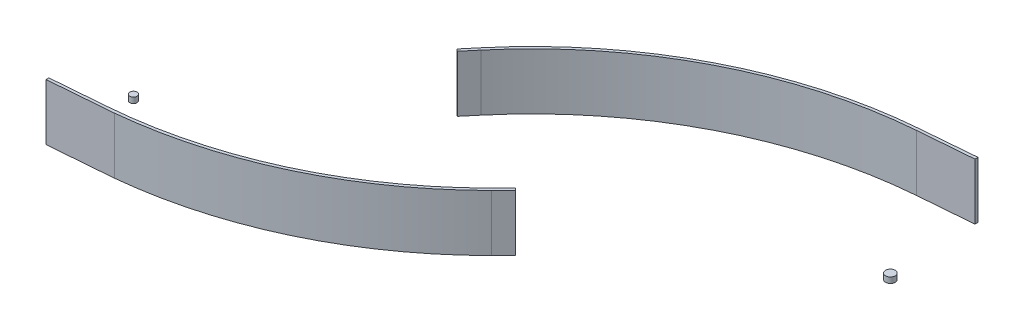
from build123d import *

# Parameters (mm, degrees)
BOSS_EXTRUDE3_DEPTH   = 100
BOSS_EXTRUDE3_2_DEPTH = 100
SKETCH4_R             = 8.59707886
BOSS_EXTRUDE4_DEPTH   = 10
SKETCH4_R_2           = 6.416603948
BOSS_EXTRUDE4_2_DEPTH = 10
SKETCH5_R             = 6.416603948
BOSS_EXTRUDE5_DEPTH   = 10
SKETCH6_R             = 6.416603948
CUT_EXTRUDE1_DEPTH    = 10
SKETCH7_R             = 8.59707886
BOSS_EXTRUDE6_DEPTH   = 10
SKETCH8_R             = 8.59707886
CUT_EXTRUDE2_DEPTH    = 10


with BuildPart() as part:
    # Sketch1 → Boss-Extrude3 (new body)
    with BuildSketch(Plane(origin=(0, 0, 0), x_dir=(1, 0, 0), z_dir=(0, 1, 0))):
        with BuildLine():
            Line((300.836036259, -319.313164732), (281.535049643, -342.279921484))
            Line((281.535049643, -342.279921484), (285.362842435, -345.496752586))
            Line((285.362842435, -345.496752586), (304.663829051, -322.529995835))
            ThreePointArc((304.663829051, -322.529995835), (532.834524357, -140.219497818), (813.63368311, -59.90252372))
            Line((813.63368311, -59.90252372), (909.895902728, -52.105727748))
            Line((909.895902728, -52.105727748), (909.895902728, -46.76563371))
            Line((909.895902728, -46.76563371), (813.230028037, -54.918844097))
            ThreePointArc((813.230028037, -54.918844097), (530.541769207, -135.776157428), (300.836036259, -319.313164732))
        make_face()
    extrude(amount=BOSS_EXTRUDE3_DEPTH)


with BuildPart() as body_2:
    # Sketch1 → Boss-Extrude3 2 (new body)
    with BuildSketch(Plane(origin=(0, 0, 0), x_dir=(1, 0, 0), z_dir=(0, 1, 0))):
        with BuildLine():
            Line((529.486382869, -528.881166176), (550.687452284, -507.655835657))
            Line((550.687452284, -507.655835657), (547.029480395, -504.002044924))
            Line((547.029480395, -504.002044924), (525.82841098, -525.227375443))
            ThreePointArc((525.82841098, -525.227375443), (312.113406405, -674.495763701), (60, -740.782905924))
            Line((60, -740.782905924), (-35.948012473, -748.554252566))
            Line((-35.948012473, -748.554252566), (-35.948012473, -753.570626388))
            Line((-35.948012473, -753.570626388), (76.311382936, -744.478132932))
            ThreePointArc((76.311382936, -744.478132932), (321.509325343, -675.797951534), (529.486382869, -528.881166176))
        make_face()
    extrude(amount=BOSS_EXTRUDE3_2_DEPTH)


with BuildPart() as body_3:
    # Sketch4 → Boss-Extrude4 (new body)
    with BuildSketch(Plane.XZ):
        with Locations(Location((909.895902728, 202.105727748, 0), (0, 0, 270))):
            Circle(SKETCH4_R)
    extrude(amount=-BOSS_EXTRUDE4_DEPTH)

    # Sketch7 → Boss-Extrude6 (add)
    with BuildSketch(Plane.XZ):
        with Locations(Location((909.895902728, 202.105727748, 0), (0, 0, 270))):
            Circle(SKETCH7_R)
    extrude(amount=BOSS_EXTRUDE6_DEPTH)

    # Sketch8 → Cut-Extrude2 (cut)
    with BuildSketch(Plane(origin=(0, 10, 0), x_dir=(1, 0, 0), z_dir=(0, 1, 0))):
        with Locations(Location((909.895902728, -202.105727748, 0), (0, 0, 90))):
            Circle(SKETCH8_R)
    extrude(amount=-CUT_EXTRUDE2_DEPTH, mode=Mode.SUBTRACT)


with BuildPart() as body_4:
    # Sketch4 → Boss-Extrude4 2 (new body)
    with BuildSketch(Plane.XZ):
        with Locations(Location((-35.948012473, 598.554252566, 0), (0, 0, 270))):
            Circle(SKETCH4_R_2)
    extrude(amount=-BOSS_EXTRUDE4_2_DEPTH)

    # Sketch5 → Boss-Extrude5 (add)
    with BuildSketch(Plane.XZ):
        with Locations(Location((-35.948012473, 598.554252566, 0), (0, 0, 270))):
            Circle(SKETCH5_R)
    extrude(amount=BOSS_EXTRUDE5_DEPTH)

    # Sketch6 → Cut-Extrude1 (cut)
    with BuildSketch(Plane(origin=(0, 10, 0), x_dir=(1, 0, 0), z_dir=(0, 1, 0))):
        with Locations(Location((-35.948012473, -598.554252566, 0), (0, 0, 90))):
            Circle(SKETCH6_R)
    extrude(amount=-CUT_EXTRUDE1_DEPTH, mode=Mode.SUBTRACT)


solid = Compound([part.part, body_2.part, body_3.part, body_4.part])
